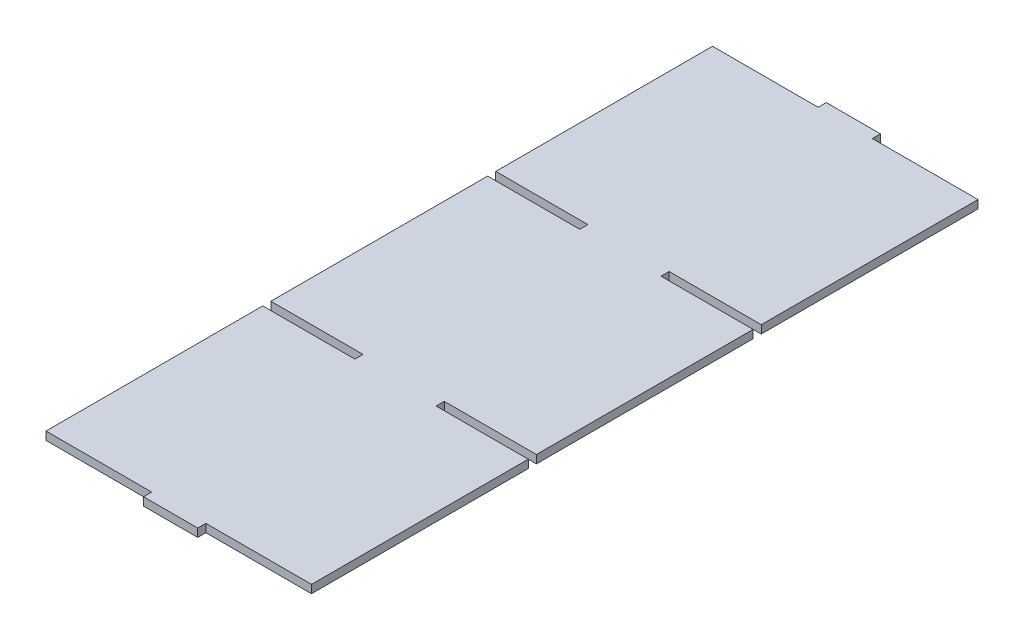
from build123d import *

# Parameters (mm, degrees)
BOSS_EXTRUDE1_DEPTH = 3


with BuildPart() as part:
    # Sketch1 → Boss-Extrude1 (new body)
    with BuildSketch(Plane(origin=(0, 0, 0), x_dir=(1, 0, 0), z_dir=(0, 1, 0))):
        Polygon((0, 0), (0, 3), (-39, 3), (-39, 83), (-5, 83), (-5, 86), (-39, 86), (-39, 166), (-5, 166), (-5, 169), (-39, 169), (-39, 249), (0, 249), (0, 252), (20, 252), (20, 249), (59, 249), (59, 169), (25, 169), (25, 166), (59, 166), (59, 86), (25, 86), (25, 83), (59, 83), (59, 3), (20, 3), (20, 0), align=None)
    extrude(amount=BOSS_EXTRUDE1_DEPTH)


solid = part.part
